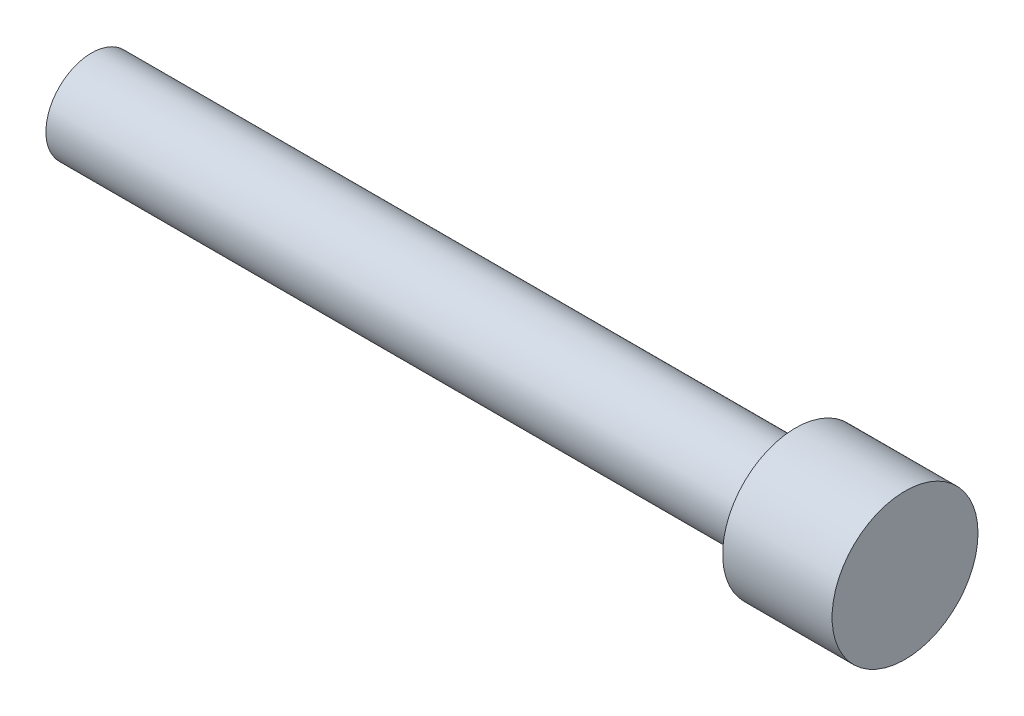
from build123d import *

# Parameters (mm, degrees)
SKETCH1_R           = 1.25
BOSS_EXTRUDE1_DEPTH = 9.65
SKETCH2_R           = 2
BOSS_EXTRUDE2_DEPTH = 3


with BuildPart() as part:
    # Sketch1 → Boss-Extrude1 (new, symmetric)
    with BuildSketch(Plane(origin=(0, 0, 0), x_dir=(0, 0, -1), z_dir=(1, 0, 0))):
        Circle(SKETCH1_R)
    extrude(amount=BOSS_EXTRUDE1_DEPTH, both=True)

    # Sketch2 → Boss-Extrude2 (add)
    with BuildSketch(Plane(origin=(9.65, 0, 0), x_dir=(0, 0, -1), z_dir=(1, 0, 0))):
        Circle(SKETCH2_R)
    extrude(amount=BOSS_EXTRUDE2_DEPTH)


solid = part.part
